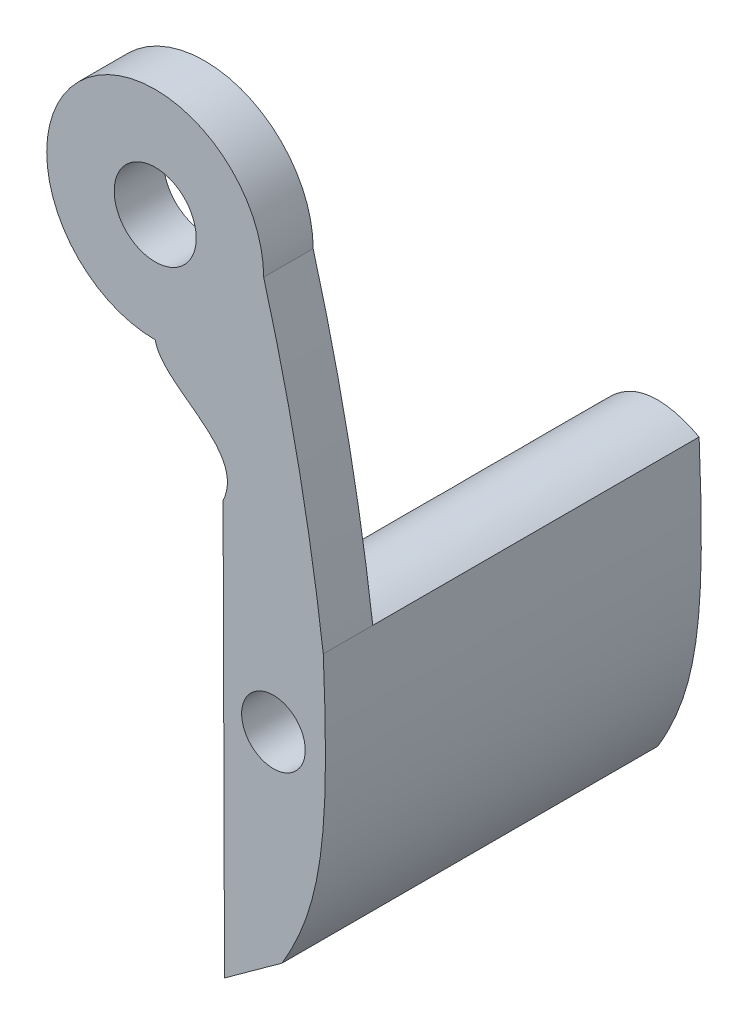
from build123d import *

# Parameters (mm, degrees)
SKETCH1_R           = 2.9
BOSS_EXTRUDE1_DEPTH = 3.5
BOSS_EXTRUDE2_DEPTH = 23.076867
SKETCH3_R           = 2.25
CUT_EXTRUDE1_DEPTH  = 90.627435024


with BuildPart() as part:
    # Sketch1 → Boss-Extrude1 (new body)
    with BuildSketch(Plane.XY.offset(4.918735516)):
        with BuildLine():
            Line((23.684222564, -79.854061858), (27.751665024, -76.911614194))
            add(Edge.make_bspline(
                [(27.751665024, -76.911614194), (30.665612651, -71.996437575), (31.13217948, -67.256532156), (30.668059578, -56.517089881)],
                knots=[0.222415535, 0.222415535, 0.222415535, 0.222415535, 0.766682965, 0.766682965, 0.766682965, 0.766682965], degree=3))
            add(Edge.make_bspline(
                [(30.668059578, -56.517089881), (29.320428981, -45.88374403), (26.453494832, -35.554786486)],
                knots=[0, 0, 0, 1, 1, 1], degree=2))
            ThreePointArc((26.453494832, -35.554786486), (13.359197662, -30.130951008), (18.783033139, -43.225248178))
            add(Edge.make_bspline(
                [(18.783033139, -43.225248178), (19.322772584, -45.817228322), (25.294082339, -46.94058971), (23.583083134, -50.662102957)],
                knots=[0, 0, 0, 0, 1, 1, 1, 1], degree=3))
            Line((23.583083134, -50.662102957), (23.608661583, -58.04483203))
            Line((23.608661583, -58.04483203), (23.684222564, -79.854061858))
        make_face()
        with Locations((18.783033139, -35.554786486)):
            Circle(SKETCH1_R, mode=Mode.SUBTRACT)
    extrude(amount=-BOSS_EXTRUDE1_DEPTH)

    # Sketch2 → Boss-Extrude2 (add)
    with BuildSketch(Plane(origin=(0, 0, 1.418735516), x_dir=(-1, 0, 0), z_dir=(0, 0, -1))):
        with BuildLine():
            Line((-27.751665024, -76.911614194), (-23.684222564, -79.854061858))
            Line((-23.684222564, -79.854061858), (-23.608661583, -58.04483203))
            add(Edge.make_bspline(
                [(-23.608661583, -58.04483203), (-26.446360253, -54.336432943), (-30.668059578, -56.51708988)],
                knots=[0, 0, 0, 1, 1, 1], degree=2))
            add(Edge.make_bspline(
                [(-30.668059578, -56.51708988), (-31.132179479, -67.256532155), (-30.665612651, -71.996437575), (-27.751665024, -76.911614194)],
                knots=[0.222415535, 0.222415535, 0.222415535, 0.222415535, 0.766682965, 0.766682965, 0.766682965, 0.766682965], degree=3))
        make_face()
    extrude(amount=BOSS_EXTRUDE2_DEPTH)

    # Sketch3 → Cut-Extrude1 (cut, through all)
    with BuildSketch(Plane.XY.offset(4.918735516)):
        with Locations((27.143723241, -63.055671712)):
            Circle(SKETCH3_R)
    extrude(amount=-CUT_EXTRUDE1_DEPTH, mode=Mode.SUBTRACT)


solid = part.part
